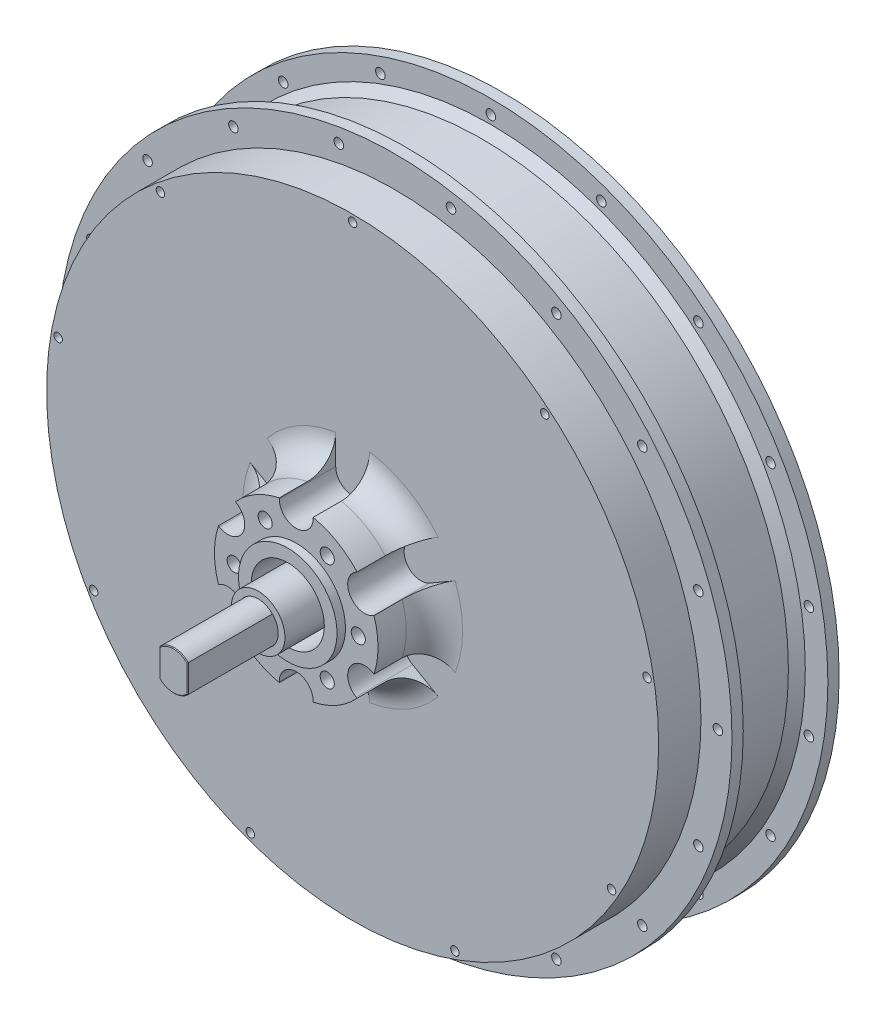
from build123d import *

# Parameters (mm, degrees)
EXTRUDE1_DEPTH  = 195
CHAMFER1_SIZE   = 0.25
SKETCH2_R       = 9.5
SKETCH2_R_2     = 7.1
EXTRUDE2_DEPTH  = 33.5
SKETCH3_R       = 17.4625
SKETCH3_R_2     = 7.1
EXTRUDE3_DEPTH  = 12
SKETCH6_R       = 1.7
EXTRUDE5_DEPTH  = 4
SKETCH7_R       = 1.7
EXTRUDE6_DEPTH  = 4
SKETCH19_R      = 9.5
SKETCH19_R_2    = 7.1
EXTRUDE20_DEPTH = 30
SKETCH14_R      = 1.5
EXTRUDE21_DEPTH = 10
SKETCH20_R      = 1.5
EXTRUDE22_DEPTH = 10
EXTRUDE23_DEPTH = 21
SKETCH23_R      = 2.5
EXTRUDE24_DEPTH = 12


with BuildPart() as part:
    # Sketch1 → Extrude1 (new body)
    with BuildSketch(Plane.XY):
        with BuildLine():
            Line((-27.434193258, 23.70411207), (-27.434193258, 13.906153099))
            ThreePointArc((-27.434193258, 13.906153099), (-22.434193258, 11.805132584), (-17.434193258, 13.906153099))
            Line((-17.434193258, 13.906153099), (-17.434193258, 23.70411207))
            ThreePointArc((-17.434193258, 23.70411207), (-22.434193258, 25.805132584), (-27.434193258, 23.70411207))
        make_face()
    extrude(amount=-EXTRUDE1_DEPTH)

    # Chamfer1
    chamfer1_edges = [part.edges().sort_by_distance(p)[0] for p in [
        (-22.434193258, 25.805132584, -195),
        (-27.434193258, 18.805132584, -195),
        (-22.434193258, 11.805132584, -195),
        (-27.434193258, 18.805132584, 0),
        (-22.434193258, 25.805132584, 0),
        (-17.434193258, 18.805132584, 0),
        (-22.434193258, 11.805132584, 0),
        (-17.434193258, 18.805132584, -195),
    ]]
    chamfer(chamfer1_edges, length=CHAMFER1_SIZE)


with BuildPart() as body_2:
    # Sketch2 → Extrude2 (new body)
    with BuildSketch(Plane(origin=(0, 0, -165), x_dir=(-1, 0, 0), z_dir=(0, 0, -1))):
        with Locations((22.434193258, 18.805132584)):
            Circle(SKETCH2_R)
        with Locations((22.434193258, 18.805132584)):
            Circle(SKETCH2_R_2, mode=Mode.SUBTRACT)
    extrude(amount=-EXTRUDE2_DEPTH)

    # Sketch3 → Extrude3 (add)
    with BuildSketch(Plane.XY.offset(-131.5)):
        with Locations((-22.434193258, 18.805132584)):
            Circle(SKETCH3_R)
        with Locations(Location((-22.434193258, 18.805132584, 0), (0, 0, 180))):
            Circle(SKETCH3_R_2, mode=Mode.SUBTRACT)
    extrude(amount=-EXTRUDE3_DEPTH)


with BuildPart() as body_3:
    # Sketch5 → Revolve1 (revolve)
    with BuildSketch(Plane(origin=(-22.434193258, 0, 0), x_dir=(0, 0, -1), z_dir=(1, 0, 0)), mode=Mode.PRIVATE) as revolve1_sk:
        with BuildLine():
            Line((109.5, 127.305132584), (112.5, 130.305132584))
            Line((112.5, 130.305132584), (112.5, 138.305132584))
            Line((112.5, 138.305132584), (116.5, 138.305132584))
            Line((116.5, 138.305132584), (116.5, 127.305132584))
            Line((116.5, 127.305132584), (123.5, 127.305132584))
            Line((123.5, 127.305132584), (123.5, 58.555132584))
            ThreePointArc((123.5, 58.555132584), (125.769922446, 53.07505503), (131.25, 50.805132584))
            Line((131.25, 50.805132584), (131.5, 50.805132584))
            Line((131.5, 50.805132584), (131.5, 25.905132584))
            Line((131.5, 25.905132584), (63.5, 25.905132584))
            Line((63.5, 25.905132584), (63.5, 31.770132584))
            Line((63.5, 31.770132584), (43.5, 31.770132584))
            Line((43.5, 31.770132584), (40.5, 31.770132584))
            Line((40.5, 31.770132584), (40.5, 36.270132584))
            Line((40.5, 36.270132584), (43.5, 36.270132584))
            Line((43.5, 36.270132584), (43.5, 47.805132584))
            Line((43.5, 47.805132584), (53.5, 47.805132584))
            ThreePointArc((53.5, 47.805132584), (60.571067812, 50.734064772), (63.5, 57.805132584))
            Line((63.5, 57.805132584), (63.5, 127.305132584))
            Line((63.5, 127.305132584), (78.5, 127.305132584))
            Line((78.5, 127.305132584), (78.5, 138.305132584))
            Line((78.5, 138.305132584), (82.5, 138.305132584))
            Line((82.5, 138.305132584), (82.5, 130.305132584))
            Line((82.5, 130.305132584), (85.5, 127.305132584))
            Line((85.5, 127.305132584), (109.5, 127.305132584))
        make_face()
    revolve(revolve1_sk.sketch.rotate(Axis((-22.434193258, 18.805132584, 0), (0, 0, -1)), 90), axis=Axis((-22.434193258, 18.805132584, 0), (0, 0, -1)))

    # Sketch6 → Extrude5 (cut)
    with BuildSketch(Plane(origin=(0, 0, -116.5), x_dir=(-1, 0, 0), z_dir=(0, 0, -1))):
        with Locations(Location((61.595499669, 126.399937664, 0), (0, 0, 90))):
            Circle(SKETCH6_R)
        with Locations(Location((22.434193258, 133.305132584, 0), (0, 0, 90))):
            Circle(SKETCH6_R)
        with Locations(Location((96.033374568, 106.517221321, 0), (0, 0, 90))):
            Circle(SKETCH6_R)
        with Locations(Location((121.594101992, 76.055132584, 0), (0, 0, 90))):
            Circle(SKETCH6_R)
        with Locations(Location((135.194680978, 38.687848927, 0), (0, 0, 90))):
            Circle(SKETCH6_R)
        with Locations(Location((135.194680978, -1.077583759, 0), (0, 0, 90))):
            Circle(SKETCH6_R)
        with Locations(Location((121.594101992, -38.444867416, 0), (0, 0, 90))):
            Circle(SKETCH6_R)
        with Locations(Location((96.033374568, -68.906956153, 0), (0, 0, 90))):
            Circle(SKETCH6_R)
        with Locations(Location((61.595499669, -88.789672496, 0), (0, 0, 90))):
            Circle(SKETCH6_R)
        with Locations(Location((22.434193258, -95.694867416, 0), (0, 0, 90))):
            Circle(SKETCH6_R)
        with Locations(Location((-16.727113152, -88.789672496, 0), (0, 0, 90))):
            Circle(SKETCH6_R)
        with Locations(Location((-51.164988051, -68.906956153, 0), (0, 0, 90))):
            Circle(SKETCH6_R)
        with Locations(Location((-76.725715475, -38.444867416, 0), (0, 0, 90))):
            Circle(SKETCH6_R)
        with Locations(Location((-90.326294461, -1.077583759, 0), (0, 0, 90))):
            Circle(SKETCH6_R)
        with Locations(Location((-90.326294461, 38.687848927, 0), (0, 0, 90))):
            Circle(SKETCH6_R)
        with Locations(Location((-76.725715475, 76.055132584, 0), (0, 0, 90))):
            Circle(SKETCH6_R)
        with Locations(Location((-51.164988051, 106.517221321, 0), (0, 0, 90))):
            Circle(SKETCH6_R)
        with Locations(Location((-16.727113152, 126.399937664, 0), (0, 0, 90))):
            Circle(SKETCH6_R)
    extrude(amount=-EXTRUDE5_DEPTH, mode=Mode.SUBTRACT)

    # Sketch7 → Extrude6 (cut)
    with BuildSketch(Plane.XY.offset(-78.5)):
        with Locations((-2.551476916, 131.565620304)):
            Circle(SKETCH7_R)
        with Locations((34.815806742, 117.965041318)):
            Circle(SKETCH7_R)
        with Locations((65.277895479, 92.404313893)):
            Circle(SKETCH7_R)
        with Locations((85.160611822, 57.966438995)):
            Circle(SKETCH7_R)
        with Locations((92.065806742, 18.805132584)):
            Circle(SKETCH7_R)
        with Locations((85.160611822, -20.356173827)):
            Circle(SKETCH7_R)
        with Locations((65.277895479, -54.794048725)):
            Circle(SKETCH7_R)
        with Locations((34.815806742, -80.354776149)):
            Circle(SKETCH7_R)
        with Locations((-2.551476916, -93.955355136)):
            Circle(SKETCH7_R)
        with Locations((-42.316909601, -93.955355136)):
            Circle(SKETCH7_R)
        with Locations((-79.684193258, -80.354776149)):
            Circle(SKETCH7_R)
        with Locations((-110.146281996, -54.794048725)):
            Circle(SKETCH7_R)
        with Locations((-130.028998338, -20.356173827)):
            Circle(SKETCH7_R)
        with Locations((-136.934193258, 18.805132584)):
            Circle(SKETCH7_R)
        with Locations((-130.028998338, 57.966438995)):
            Circle(SKETCH7_R)
        with Locations((-110.146281996, 92.404313893)):
            Circle(SKETCH7_R)
        with Locations((-79.684193258, 117.965041318)):
            Circle(SKETCH7_R)
        with Locations((-42.316909601, 131.565620304)):
            Circle(SKETCH7_R)
    extrude(amount=-EXTRUDE6_DEPTH, mode=Mode.SUBTRACT)

    # Sketch14 → Extrude21 (cut)
    with BuildSketch(Plane.XY.offset(-63.5)):
        with Locations((45.701293368, 100.005843555)):
            Circle(SKETCH14_R)
        with Locations((-22.434193258, 124.805132584)):
            Circle(SKETCH14_R)
        with Locations((81.955428561, 37.211839417)):
            Circle(SKETCH14_R)
        with Locations((69.364499543, -34.194867416)):
            Circle(SKETCH14_R)
        with Locations((13.819941934, -80.802285219)):
            Circle(SKETCH14_R)
        with Locations((-58.688328451, -80.802285219)):
            Circle(SKETCH14_R)
        with Locations((-114.23288606, -34.194867416)):
            Circle(SKETCH14_R)
        with Locations((-126.823815078, 37.211839417)):
            Circle(SKETCH14_R)
        with Locations((-90.569679885, 100.005843555)):
            Circle(SKETCH14_R)
    extrude(amount=-EXTRUDE21_DEPTH, mode=Mode.SUBTRACT)

    # Sketch20 → Extrude22 (cut)
    with BuildSketch(Plane(origin=(0, 0, -123.5), x_dir=(-1, 0, 0), z_dir=(0, 0, -1))):
        with Locations((-13.819941934, 118.412550388)):
            Circle(SKETCH20_R)
        with Locations((58.688328451, 118.412550388)):
            Circle(SKETCH20_R)
        with Locations((114.23288606, 71.805132584)):
            Circle(SKETCH20_R)
        with Locations((126.823815078, 0.398425752)):
            Circle(SKETCH20_R)
        with Locations((90.569679885, -62.395578386)):
            Circle(SKETCH20_R)
        with Locations((22.434193258, -87.194867416)):
            Circle(SKETCH20_R)
        with Locations((-45.701293368, -62.395578386)):
            Circle(SKETCH20_R)
        with Locations((-81.955428561, 0.398425752)):
            Circle(SKETCH20_R)
        with Locations((-69.364499543, 71.805132584)):
            Circle(SKETCH20_R)
    extrude(amount=-EXTRUDE22_DEPTH, mode=Mode.SUBTRACT)

    # Sketch22 → Extrude23 (cut)
    with BuildSketch(Plane.XY.offset(-63.5)):
        with BuildLine():
            Line((-1.185481952, 38.001285007), (8.595894532, 43.648565353))
            ThreePointArc((8.595894532, 43.648565353), (11.990316542, 38.680132584), (14.595894532, 33.256260508))
            Line((14.595894532, 33.256260508), (4.814518048, 27.608980162))
            ThreePointArc((4.814518048, 27.608980162), (-3.381634375, 29.805132584), (-1.185481952, 38.001285007))
        make_face()
        with BuildLine():
            Line((4.814518048, 10.001285007), (14.595894532, 4.354004661))
            ThreePointArc((14.595894532, 4.354004661), (11.990316542, -1.069867416), (8.595894532, -6.038300185))
            Line((8.595894532, -6.038300185), (-1.185481952, -0.391019838))
            ThreePointArc((-1.185481952, -0.391019838), (-3.381634375, 7.805132584), (4.814518048, 10.001285007))
        make_face()
        with BuildLine():
            Line((-16.434193258, -9.194867416), (-16.434193258, -20.489428108))
            ThreePointArc((-16.434193258, -20.489428108), (-22.434193258, -20.944867416), (-28.434193258, -20.489428108))
            Line((-28.434193258, -20.489428108), (-28.434193258, -9.194867416))
            ThreePointArc((-28.434193258, -9.194867416), (-22.434193258, -3.194867416), (-16.434193258, -9.194867416))
        make_face()
        with BuildLine():
            Line((-43.682904564, -0.391019838), (-53.464281048, -6.038300185))
            ThreePointArc((-53.464281048, -6.038300185), (-56.858703059, -1.069867416), (-59.464281048, 4.354004661))
            Line((-59.464281048, 4.354004661), (-49.682904564, 10.001285007))
            ThreePointArc((-49.682904564, 10.001285007), (-41.486752142, 7.805132584), (-43.682904564, -0.391019838))
        make_face()
        with BuildLine():
            Line((-49.682904564, 27.608980162), (-59.464281048, 33.256260508))
            ThreePointArc((-59.464281048, 33.256260508), (-56.858703059, 38.680132584), (-53.464281048, 43.648565353))
            Line((-53.464281048, 43.648565353), (-43.682904564, 38.001285007))
            ThreePointArc((-43.682904564, 38.001285007), (-41.486752142, 29.805132584), (-49.682904564, 27.608980162))
        make_face()
        with BuildLine():
            Line((-28.434193258, 46.805132584), (-28.434193258, 58.099693277))
            ThreePointArc((-28.434193258, 58.099693277), (-22.434193258, 58.555132584), (-16.434193258, 58.099693277))
            Line((-16.434193258, 58.099693277), (-16.434193258, 46.805132584))
            ThreePointArc((-16.434193258, 46.805132584), (-22.434193258, 40.805132584), (-28.434193258, 46.805132584))
        make_face()
    extrude(amount=EXTRUDE23_DEPTH, mode=Mode.SUBTRACT)

    # Sketch23 → Extrude24 (cut)
    with BuildSketch(Plane.XY.offset(-43.5)):
        with Locations((-33.434193258, 37.857691468)):
            Circle(SKETCH23_R)
        with Locations((-11.434193258, 37.857691468)):
            Circle(SKETCH23_R)
        with Locations((-0.434193258, 18.805132584)):
            Circle(SKETCH23_R)
        with Locations((-11.434193258, -0.247426299)):
            Circle(SKETCH23_R)
        with Locations((-33.434193258, -0.247426299)):
            Circle(SKETCH23_R)
        with Locations((-44.434193258, 18.805132584)):
            Circle(SKETCH23_R)
    extrude(amount=-EXTRUDE24_DEPTH, mode=Mode.SUBTRACT)


with BuildPart() as body_4:
    # Sketch19 → Extrude20 (new body)
    with BuildSketch(Plane.XY.offset(-30)):
        with Locations((-22.434193258, 18.805132584)):
            Circle(SKETCH19_R)
        with Locations((-22.434193258, 18.805132584)):
            Circle(SKETCH19_R_2, mode=Mode.SUBTRACT)
    extrude(amount=-EXTRUDE20_DEPTH)


solid = Compound([part.part, body_2.part, body_3.part, body_4.part])
